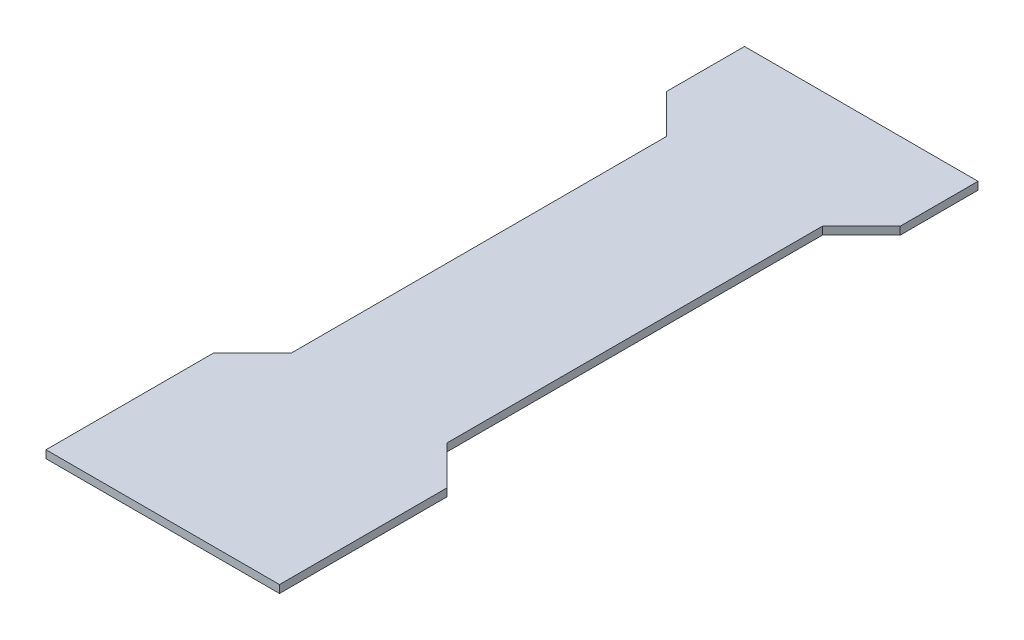
from build123d import *

# Parameters (mm, degrees)
EXTRUDE_1_DEPTH = 2


with BuildPart() as part:
    # 草图1 → 凸台-拉伸1 (new body)
    with BuildSketch(Plane(origin=(0, 0, 0), x_dir=(1, 0, 0), z_dir=(0, 1, 0))):
        Polygon((30, 159.5), (30, 179.5), (-30, 179.5), (-30, 159.5), (-20, 149.5), (-20, 139.5), (-20, 53), (-30, 43), (-30, 0), (0, 0), (30, 0), (30, 43), (20, 53), (20, 139.5), (20, 149.5), align=None)
    extrude(amount=EXTRUDE_1_DEPTH)


solid = part.part
